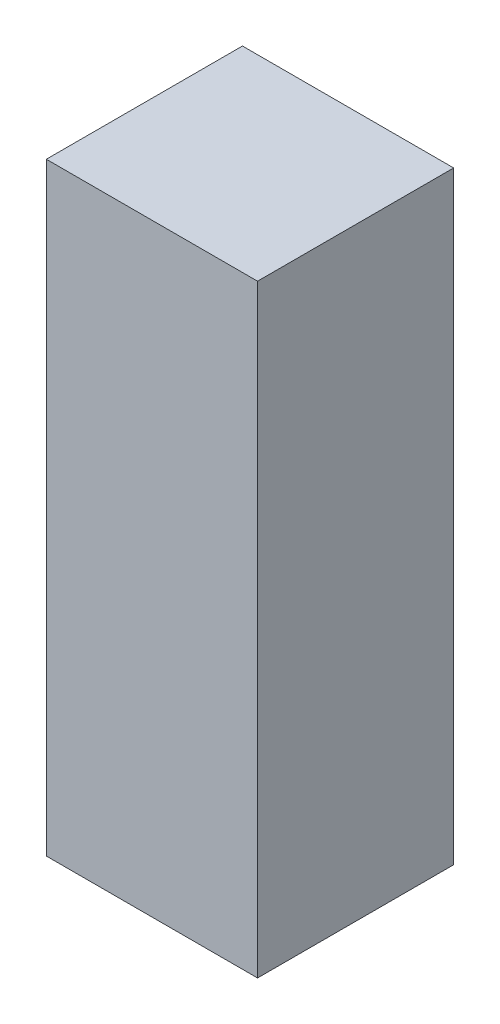
from build123d import *

# Parameters (mm, degrees)
OVEN_FAN_FILTRE_KAPAGI_MENTESE_2_1_START = 20
SKETCH1_W                                = 14
SKETCH1_H                                = 40
OVEN_FAN_FILTRE_KAPAGI_MENTESE_2_1_DEPTH = 13


with BuildPart() as part:
    # Sketch1 → OVEN_fan_filtre_kapagi_mentese_2_1 (new body)
    with BuildSketch(Plane.XY.offset(OVEN_FAN_FILTRE_KAPAGI_MENTESE_2_1_START)):
        with Locations((31, 1890)):
            Rectangle(SKETCH1_W, SKETCH1_H)
    extrude(amount=OVEN_FAN_FILTRE_KAPAGI_MENTESE_2_1_DEPTH)


solid = part.part
